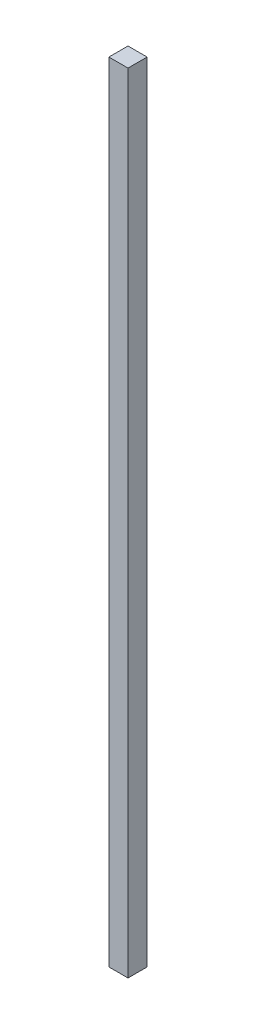
from build123d import *

# Parameters (mm, degrees)
TOPPING_SAG_KANAL_KABLO_KANALI_1_START = -660
SKETCH1_W                              = 40
SKETCH1_H                              = 1650
TOPPING_SAG_KANAL_KABLO_KANALI_1_DEPTH = 40


with BuildPart() as part:
    # Sketch1 → TOPPING_sag_kanal_kablo_kanali_1 (new body)
    with BuildSketch(Plane.XY.offset(TOPPING_SAG_KANAL_KABLO_KANALI_1_START)):
        with Locations((632.5, 1075)):
            Rectangle(SKETCH1_W, SKETCH1_H)
    extrude(amount=-TOPPING_SAG_KANAL_KABLO_KANALI_1_DEPTH)


solid = part.part
